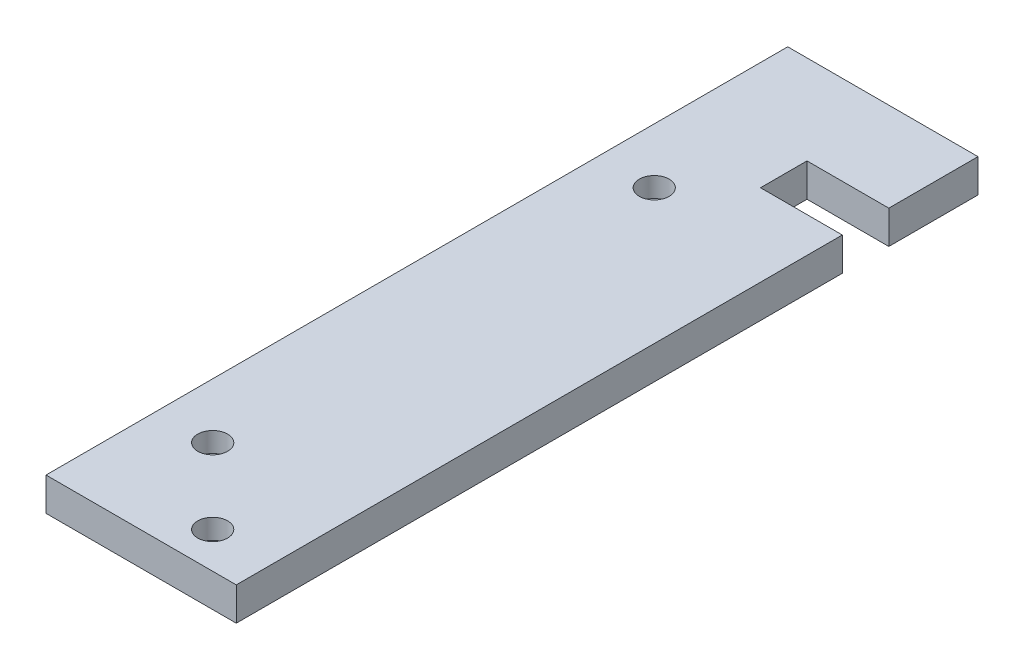
from build123d import *

# Parameters (mm, degrees)
EXTRUDE_1_DEPTH     = 5
SKETCH_1_12_R       = 1.5
CUT_EXTRUDE_1_DEPTH = 116.382644488
CUT_EXTRUDE_START   = 5
SKETCH_1_13_R       = 2.25
CUT_EXTRUDE_3_DEPTH = 3


with BuildPart() as part:
    # 草图1 → 凸台-拉伸1 (new body)
    with BuildSketch(Plane(origin=(0, 0, 0), x_dir=(1, 0, 0), z_dir=(0, 1, 0))):
        Polygon((-28.642135833, 0), (0, 0), (0, 91.231745931), (-12.313708499, 91.231745931), (-12.313708499, 98.231745931), (0, 98.231745931), (0, 111.65922579), (-28.642135833, 111.65922579), align=None)
    extrude(amount=EXTRUDE_1_DEPTH)

    # 草图1<12> → 切除-拉伸1 (cut, through all)
    with BuildSketch(Plane(origin=(0, 0, 0), x_dir=(1, 0, 0), z_dir=(0, 1, 0))):
        with Locations(Location((-20.313708499, 83.231745931, 0), (0, 0, 270))):
            Circle(SKETCH_1_12_R)
        with Locations(Location((-20.313708499, 16.763708499, 0), (0, 0, 270))):
            Circle(SKETCH_1_12_R)
        with Locations(Location((-9, 5.45, 0), (0, 0, 270))):
            Circle(SKETCH_1_12_R)
    extrude(amount=CUT_EXTRUDE_1_DEPTH, mode=Mode.SUBTRACT)

    # 草图1<13> → 切除-拉伸3 (cut)
    with BuildSketch(Plane(origin=(0, 0, 0), x_dir=(1, 0, 0), z_dir=(0, 1, 0)).offset(CUT_EXTRUDE_START)):
        with Locations(Location((-20.313708499, 83.231745931, 0), (0, 0, 270))):
            Circle(SKETCH_1_13_R)
        with Locations(Location((-9, 5.45, 0), (0, 0, 270))):
            Circle(SKETCH_1_13_R)
        with Locations(Location((-20.313708499, 16.763708499, 0), (0, 0, 270))):
            Circle(SKETCH_1_13_R)
    extrude(amount=-CUT_EXTRUDE_3_DEPTH, mode=Mode.SUBTRACT)


solid = part.part
